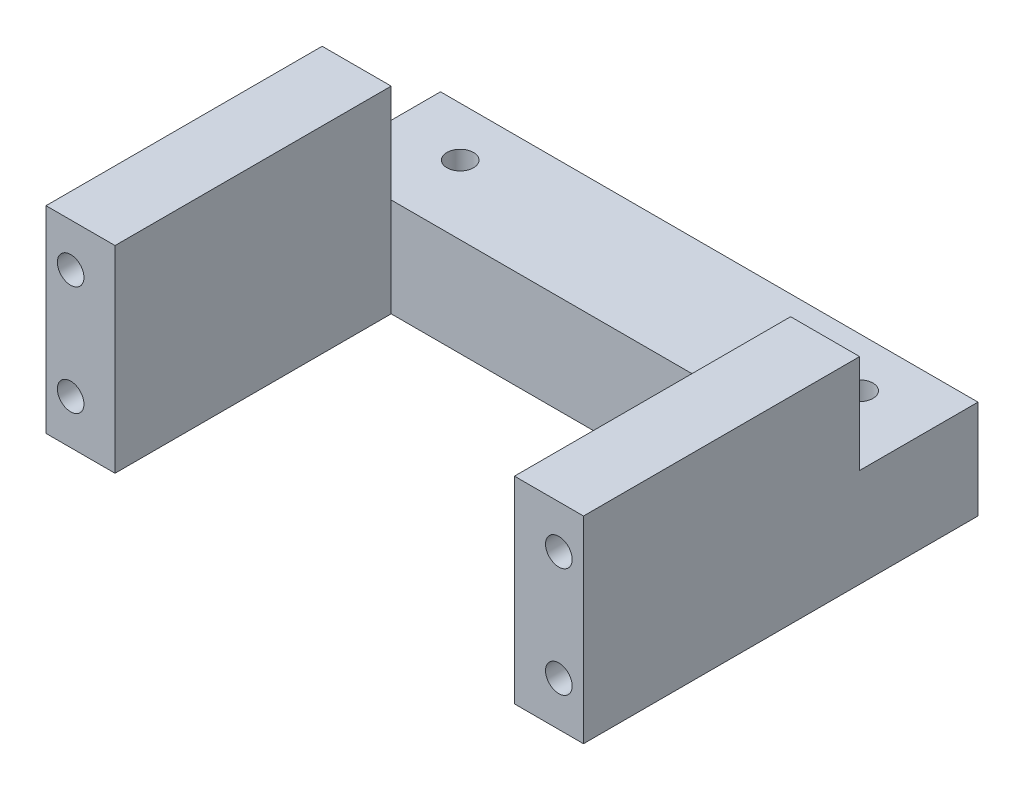
from build123d import *

# Parameters (mm, degrees)
CROQUIS1_R              = 1.35
SALIENTE_EXTRUIR1_DEPTH = 10
CROQUIS2_W              = 7
CROQUIS2_H              = 28
SALIENTE_EXTRUIR2_DEPTH = 20
CROQUIS3_R              = 1.35
CORTAR_EXTRUIR1_DEPTH   = 15


with BuildPart() as part:
    # Croquis1 → Saliente-Extruir1 (new body)
    with BuildSketch(Plane(origin=(0, 0, 0), x_dir=(1, 0, 0), z_dir=(0, 1, 0))):
        Polygon((-20.25, -20), (-20.25, 8), (20.25, 8), (20.25, -20), (27.25, -20), (27.25, 20), (-27.25, 20), (-27.25, -20), align=None)
        with Locations(Location((-20.25, 15, 0), (0, 0, 270))):
            Circle(CROQUIS1_R, mode=Mode.SUBTRACT)
        with Locations(Location((20.25, 15, 0), (0, 0, 90))):
            Circle(CROQUIS1_R, mode=Mode.SUBTRACT)
    extrude(amount=SALIENTE_EXTRUIR1_DEPTH)

    # Croquis2 → Saliente-Extruir2 (add)
    with BuildSketch(Plane(origin=(0, 0, 0), x_dir=(1, 0, 0), z_dir=(0, 1, 0))):
        with Locations((-23.75, -6)):
            Rectangle(CROQUIS2_W, CROQUIS2_H)
        with Locations((23.75, -6)):
            Rectangle(CROQUIS2_W, CROQUIS2_H)
    extrude(amount=SALIENTE_EXTRUIR2_DEPTH)

    # Croquis3 → Cortar-Extruir1 (cut)
    with BuildSketch(Plane.XY.offset(20)):
        with Locations((-24.75, 15.612517806)):
            Circle(CROQUIS3_R)
        with Locations((-24.75, 4.5)):
            Circle(CROQUIS3_R)
        with Locations(Location((24.75, 4.5, 0), (0, 0, 180))):
            Circle(CROQUIS3_R)
        with Locations(Location((24.75, 15.612517806, 0), (0, 0, 180))):
            Circle(CROQUIS3_R)
    extrude(amount=-CORTAR_EXTRUIR1_DEPTH, mode=Mode.SUBTRACT)


solid = part.part
